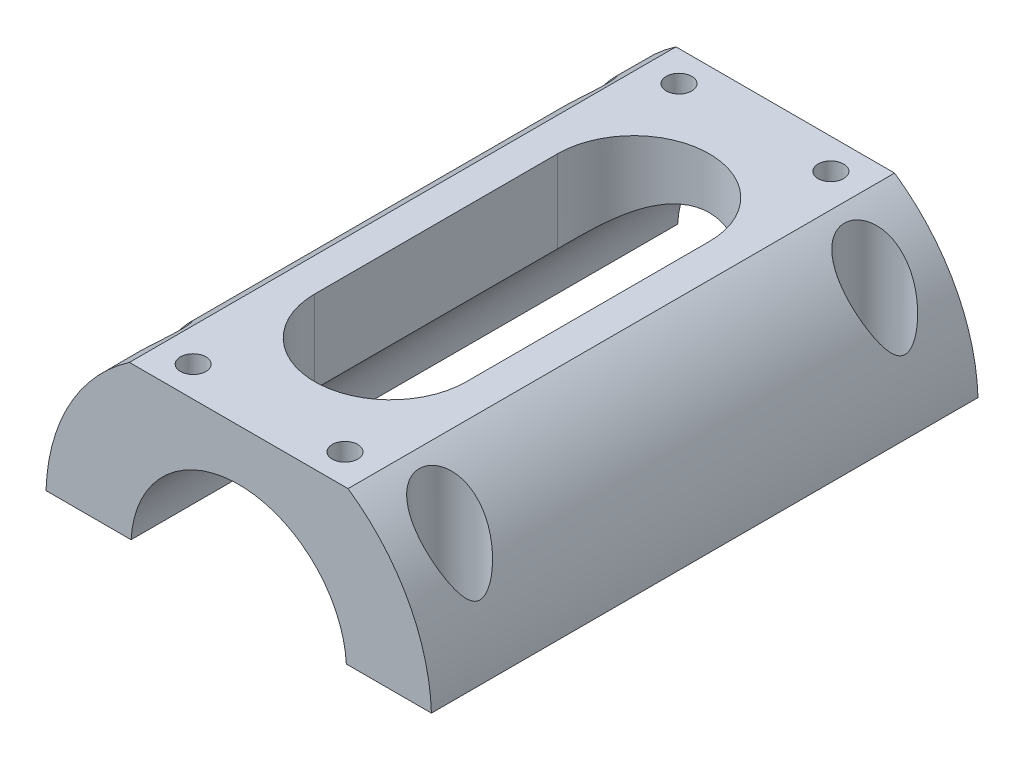
from build123d import *

# Parameters (mm, degrees)
BOSS_EXTRUDE1_DEPTH             = 90
F_5_0MM_CLEARANCE_DOWEL_HOLE1_D = 5
CUT_EXTRUDE1_REACH              = 101.384
CUT_EXTRUDE1_END_RADIUS         = 31.75
SKETCH4_R                       = 5
CUT_EXTRUDE3_DEPTH              = 101.5739779
CUT_EXTRUDE4_REACH              = 100.691
TAP_DRILL_FOR_M5X0_8_TAP1_D     = 4.2
TAP_DRILL_FOR_M5X0_8_TAP1_DEPTH = 8
TAP_DRILL_FOR_M5X0_8_TAP1_TIP   = 1.2618073


with BuildPart() as part:
    # Sketch1 → Boss-Extrude1 (new body)
    with BuildSketch(Plane.XY):
        with BuildLine():
            Line((-31.734248061, 1), (-17.721808598, 1))
            ThreePointArc((-17.721808598, 1), (0, 17.75), (17.721808598, 1))
            Line((17.721808598, 1), (31.734248061, 1))
            ThreePointArc((31.734248061, 1), (0, 31.75), (-31.734248061, 1))
        make_face()
    extrude(amount=BOSS_EXTRUDE1_DEPTH)

    # Ø5.0mm Clearance Dowel Hole1 (through all)
    with Locations(Plane(origin=(-24.72802833, 1, 80), x_dir=(0, 0, -1), z_dir=(0, -1, 0))):
        with Locations((0, 0), (70, 0), (0, 49.45605666), (70, 49.45605666)):
            Hole(F_5_0MM_CLEARANCE_DOWEL_HOLE1_D / 2)

    # Cut-Extrude1: up to this cylinder (the profile starts inside it)
    cut_extrude1_end = Plane(origin=(0, 0, 45), z_dir=(0, 0, -1)) * Cylinder(CUT_EXTRUDE1_END_RADIUS, 337.268, mode=Mode.PRIVATE)
    # Sketch4 → Cut-Extrude1 (cut, up to the surface)
    with BuildSketch(Plane(origin=(0, 4, 0), x_dir=(-1, 0, 0), z_dir=(0, -1, 0)), mode=Mode.PRIVATE) as cut_extrude1_sk1:
        with Locations(Location((24.72802833, -80, 0), (0, 0, 90))):
            Circle(SKETCH4_R)
    cut_extrude1_tool1 = extrude(cut_extrude1_sk1.sketch, amount=-CUT_EXTRUDE1_REACH, mode=Mode.PRIVATE) & cut_extrude1_end
    add(cut_extrude1_tool1.solids().sort_by_distance((-24.728028, 4, 80))[0], mode=Mode.SUBTRACT)
    # Sketch4 → Cut-Extrude1 (cut, up to the surface)
    with BuildSketch(Plane(origin=(0, 4, 0), x_dir=(-1, 0, 0), z_dir=(0, -1, 0)), mode=Mode.PRIVATE) as cut_extrude1_sk2:
        with Locations(Location((24.72802833, -10, 0), (0, 0, 90))):
            Circle(SKETCH4_R)
    cut_extrude1_tool2 = extrude(cut_extrude1_sk2.sketch, amount=-CUT_EXTRUDE1_REACH, mode=Mode.PRIVATE) & cut_extrude1_end
    add(cut_extrude1_tool2.solids().sort_by_distance((-24.728028, 4, 10))[0], mode=Mode.SUBTRACT)
    # Sketch4 → Cut-Extrude1 (cut, up to the surface)
    with BuildSketch(Plane(origin=(0, 4, 0), x_dir=(-1, 0, 0), z_dir=(0, -1, 0)), mode=Mode.PRIVATE) as cut_extrude1_sk3:
        with Locations(Location((-24.72802833, -10, 0), (0, 0, 90))):
            Circle(SKETCH4_R)
    cut_extrude1_tool3 = extrude(cut_extrude1_sk3.sketch, amount=-CUT_EXTRUDE1_REACH, mode=Mode.PRIVATE) & cut_extrude1_end
    add(cut_extrude1_tool3.solids().sort_by_distance((24.728028, 4, 10))[0], mode=Mode.SUBTRACT)
    # Sketch4 → Cut-Extrude1 (cut, up to the surface)
    with BuildSketch(Plane(origin=(0, 4, 0), x_dir=(-1, 0, 0), z_dir=(0, -1, 0)), mode=Mode.PRIVATE) as cut_extrude1_sk4:
        with Locations(Location((-24.72802833, -80, 0), (0, 0, 90))):
            Circle(SKETCH4_R)
    cut_extrude1_tool4 = extrude(cut_extrude1_sk4.sketch, amount=-CUT_EXTRUDE1_REACH, mode=Mode.PRIVATE) & cut_extrude1_end
    add(cut_extrude1_tool4.solids().sort_by_distance((24.728028, 4, 80))[0], mode=Mode.SUBTRACT)

    # Sketch8 → Cut-Extrude3 (cut, through all)
    with BuildSketch(Plane.XY.offset(90)):
        with BuildLine():
            Line((18, 26.154588508), (-18, 26.154588508))
            ThreePointArc((-18, 26.154588508), (0, 31.75), (18, 26.154588508))
        make_face()
    extrude(amount=-CUT_EXTRUDE3_DEPTH, mode=Mode.SUBTRACT)

    # Sketch9 → Cut-Extrude4 (cut, up to next)
    with BuildSketch(Plane.XZ.offset(-1), mode=Mode.PRIVATE) as cut_extrude4_sk1:
        with BuildLine():
            Line((-12.5, 25), (-12.5, 65))
            ThreePointArc((-12.5, 65), (0, 77.5), (12.5, 65))
            Line((12.5, 65), (12.5, 25))
            ThreePointArc((12.5, 25), (0, 12.5), (-12.5, 25))
        make_face()
    cut_extrude4_tool1 = extrude(cut_extrude4_sk1.sketch, amount=-CUT_EXTRUDE4_REACH, mode=Mode.PRIVATE) & part.part
    add(cut_extrude4_tool1.solids().sort_by_distance((0, 1, 45))[0], mode=Mode.SUBTRACT)

    # Tap Drill for M5x0.8 Tap1
    with Locations(Plane(origin=(-12.5, 26.154588508, 5), x_dir=(0, 0, 1), z_dir=(0, 1, 0))):
        with Locations((0, 0), (0, 25), (80, 25), (80, 0)):
            Hole(TAP_DRILL_FOR_M5X0_8_TAP1_D / 2, depth=TAP_DRILL_FOR_M5X0_8_TAP1_DEPTH)
            with Locations((0, 0, -(TAP_DRILL_FOR_M5X0_8_TAP1_DEPTH + TAP_DRILL_FOR_M5X0_8_TAP1_TIP / 2))):  # 118° drill point
                Cone(0, TAP_DRILL_FOR_M5X0_8_TAP1_D / 2, TAP_DRILL_FOR_M5X0_8_TAP1_TIP, mode=Mode.SUBTRACT)


solid = part.part
